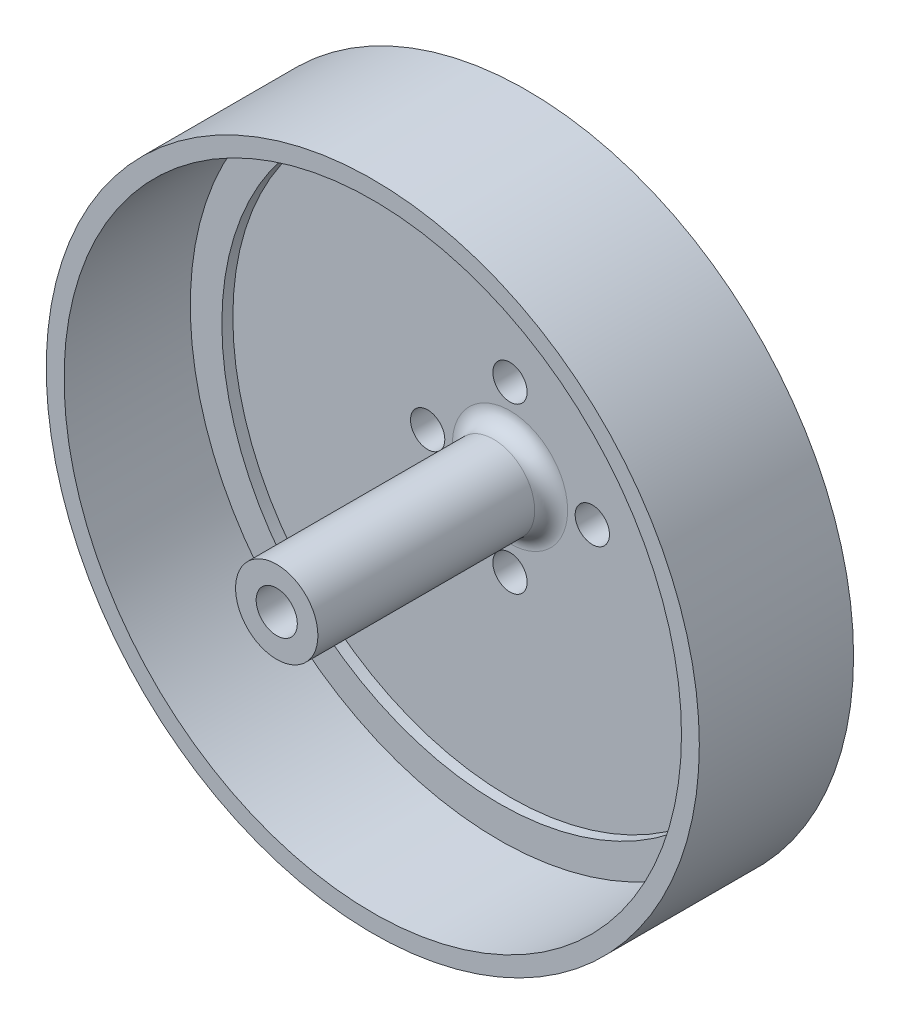
from build123d import *

# Parameters (mm, degrees)
SKETCH1_R               = 23.8
BOSS_EXTRUDE1_DEPTH     = 2.3
SKETCH2_R               = 23.8
SKETCH2_R_2             = 20.2
BOSS_EXTRUDE2_DEPTH     = 10
SKETCH3_R               = 3
BOSS_EXTRUDE3_DEPTH     = 17
CHAMFER1_SIZE           = 6
CHAMFER1_SIZE2          = 1.057961884
SKETCH4_R               = 1.25
CUT_EXTRUDE1_DEPTH      = 15
CUT_EXTRUDE3_START      = -9.2
SKETCH6_R               = 22.5
SKETCH6_R_2             = 20.2
CUT_EXTRUDE3_DEPTH      = 9.2
SKETCH7_R               = 1.5
CUT_EXTRUDE4_DEPTH      = 5
REDONDEO1_R             = 1.2
SALIENTE_EXTRUIR1_START = 1.6
CROQUIS1_R              = 9.339254136
CROQUIS1_R_2            = 1.25
SALIENTE_EXTRUIR1_DEPTH = 1.6
CROQUIS2_R              = 2
SALIENTE_EXTRUIR2_DEPTH = 3


with BuildPart() as part:
    # Sketch1 → Boss-Extrude1 (new body)
    with BuildSketch(Plane.XY):
        Circle(SKETCH1_R)
    extrude(amount=BOSS_EXTRUDE1_DEPTH)

    # Sketch2 → Boss-Extrude2 (add)
    with BuildSketch(Plane.XY.offset(2.3)):
        Circle(SKETCH2_R)
        Circle(SKETCH2_R_2, mode=Mode.SUBTRACT)
    extrude(amount=BOSS_EXTRUDE2_DEPTH)

    # Sketch3 → Boss-Extrude3 (add)
    with BuildSketch(Plane.XY.offset(2.3)):
        Circle(SKETCH3_R)
    extrude(amount=BOSS_EXTRUDE3_DEPTH)

    # Chamfer1
    chamfer1_edges = [part.edges().sort_by_distance(p)[0] for p in [
        (-23.8, 0, 0),
    ]]
    chamfer1_side = [part.faces().sort_by_distance(p)[0] for p in [
        (0, 0, 0),
    ]]
    chamfer(chamfer1_edges, length=CHAMFER1_SIZE, length2=CHAMFER1_SIZE2, reference=chamfer1_side[0])

    # Sketch4 → Cut-Extrude1 (cut)
    with BuildSketch(Plane(origin=(0, 0, 0), x_dir=(-1, 0, 0), z_dir=(0, 0, -1))):
        with Locations((6, 0)):
            Circle(SKETCH4_R)
        with Locations((0, -6)):
            Circle(SKETCH4_R)
        with Locations((-6, 0)):
            Circle(SKETCH4_R)
        with Locations((0, 6)):
            Circle(SKETCH4_R)
    extrude(amount=-CUT_EXTRUDE1_DEPTH, mode=Mode.SUBTRACT)

    # Sketch6 → Cut-Extrude3 (cut)
    with BuildSketch(Plane.XY.offset(12.3).offset(CUT_EXTRUDE3_START)):
        Circle(SKETCH6_R)
        Circle(SKETCH6_R_2, mode=Mode.SUBTRACT)
    extrude(amount=CUT_EXTRUDE3_DEPTH, mode=Mode.SUBTRACT)

    # Sketch7 → Cut-Extrude4 (cut)
    with BuildSketch(Plane.XY.offset(19.3)):
        Circle(SKETCH7_R)
    extrude(amount=-CUT_EXTRUDE4_DEPTH, mode=Mode.SUBTRACT)

    # Redondeo1
    redondeo1_edges = [part.edges().sort_by_distance(p)[0] for p in [
        (-3, 0, 2.3),
    ]]
    fillet(redondeo1_edges, radius=REDONDEO1_R)

    # Croquis1 → Saliente-Extruir1 (add)
    with BuildSketch(Plane(origin=(0, 0, 0), x_dir=(-1, 0, 0), z_dir=(0, 0, -1)).offset(SALIENTE_EXTRUIR1_START)):
        Circle(CROQUIS1_R)
        with Locations((0, 6)):
            Circle(CROQUIS1_R_2, mode=Mode.SUBTRACT)
        with Locations((6, 0)):
            Circle(CROQUIS1_R_2, mode=Mode.SUBTRACT)
        with Locations((0, -6)):
            Circle(CROQUIS1_R_2, mode=Mode.SUBTRACT)
        with Locations((-6, 0)):
            Circle(CROQUIS1_R_2, mode=Mode.SUBTRACT)
    extrude(amount=-SALIENTE_EXTRUIR1_DEPTH)

    # Croquis2 → Saliente-Extruir2 (add)
    with BuildSketch(Plane(origin=(0, 0, -1.6), x_dir=(-1, 0, 0), z_dir=(0, 0, -1))):
        Circle(CROQUIS2_R)
    extrude(amount=SALIENTE_EXTRUIR2_DEPTH)


solid = part.part
